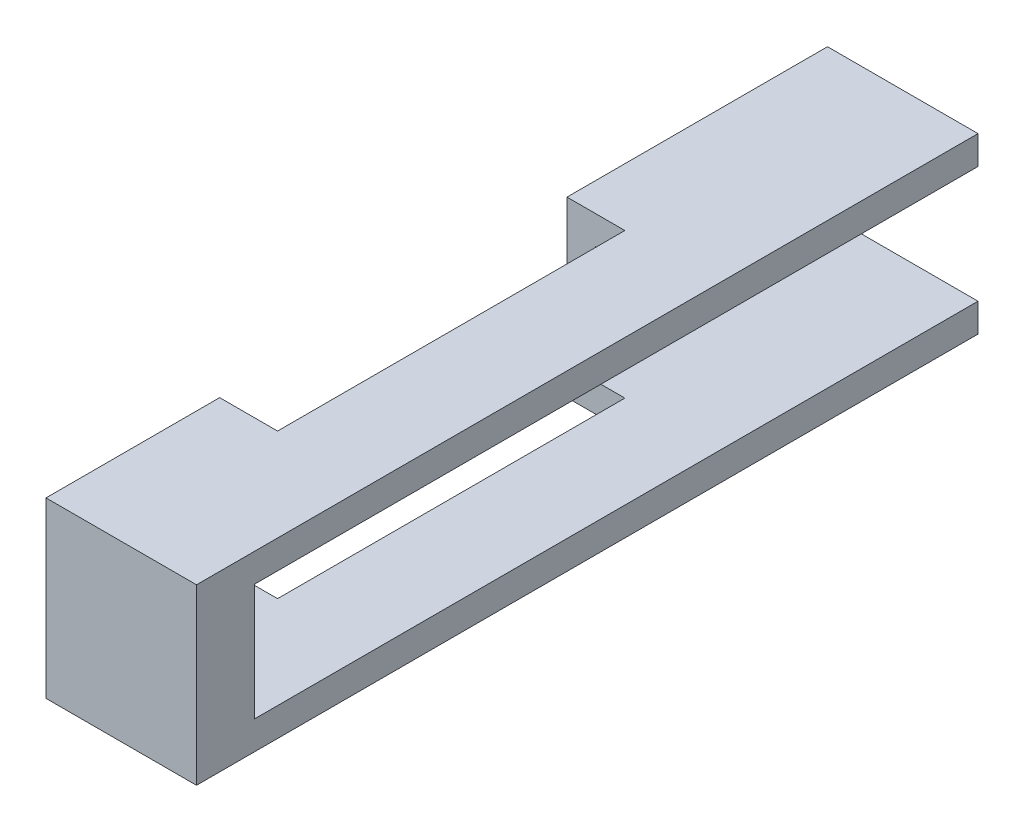
from build123d import *

# Parameters (mm, degrees)
SKETCH_1_W          = 30
SKETCH_1_H          = 30
EXTRUDE_1_DEPTH     = 30
SKETCH_2_W          = 20
SKETCH_2_H          = 20.05
CUT_EXTRUDE_1_DEPTH = 20
CUT_EXTRUDE_2_DEPTH = 20
SKETCH_4_W          = 5
SKETCH_4_H          = 30
CUT_EXTRUDE_3_DEPTH = 55
SKETCH_5_W          = 15
SKETCH_5_H          = 4.975
EXTRUDE_2_DEPTH     = 120
EXTRUDE_3_DEPTH     = 60
SKETCH_7_R          = 3.1
CUT_EXTRUDE_4_DEPTH = 60
CUT_EXTRUDE_5_REACH = 155.704
SKETCH_8_W          = 20.1
SKETCH_8_H          = 20.15
EXTRUDE_4_DEPTH     = 1
SKETCH_10_W         = 26
SKETCH_10_H         = 15
CUT_EXTRUDE_6_DEPTH = 87


with BuildPart() as part:
    # 草图1 → 凸台-拉伸1 (new body)
    with BuildSketch(Plane(origin=(0, 0, 0), x_dir=(1, 0, 0), z_dir=(0, 1, 0))):
        Rectangle(SKETCH_1_W, SKETCH_1_H)
    extrude(amount=EXTRUDE_1_DEPTH)

    # 草图2 → 切除-拉伸1 (cut)
    with BuildSketch(Plane(origin=(15, 0, 0), x_dir=(0, 0, -1), z_dir=(1, 0, 0))):
        with Locations((5, 15)):
            Rectangle(SKETCH_2_W, SKETCH_2_H)
    extrude(amount=-CUT_EXTRUDE_1_DEPTH, mode=Mode.SUBTRACT)

    # 草图3 → 切除-拉伸2 (cut)
    with BuildSketch(Plane(origin=(-5, 0, 0), x_dir=(0, 0, -1), z_dir=(1, 0, 0))):
        with BuildLine():
            ThreePointArc((7.189292698, 17.194765929), (5, 18.1), (2.810707302, 17.194765929))
            Line((2.810707302, 17.194765929), (5, 15))
            Line((5, 15), (7.189292698, 17.194765929))
        make_face()
        with BuildLine():
            Line((5, 15), (2.810707302, 17.194765929))
            ThreePointArc((2.810707302, 17.194765929), (1.9, 15), (2.810707302, 12.805234071))
            Line((2.810707302, 12.805234071), (5, 15))
        make_face()
        with BuildLine():
            Line((7.189292698, 17.194765929), (5, 15))
            Line((5, 15), (7.189292698, 12.805234071))
            ThreePointArc((7.189292698, 12.805234071), (7.86328547, 13.81189381), (8.1, 15))
            ThreePointArc((8.1, 15), (7.86328547, 16.18810619), (7.189292698, 17.194765929))
        make_face()
        with BuildLine():
            Line((7.189292698, 12.805234071), (5, 15))
            Line((5, 15), (2.810707302, 12.805234071))
            ThreePointArc((2.810707302, 12.805234071), (5, 11.9), (7.189292698, 12.805234071))
        make_face()
    extrude(amount=-CUT_EXTRUDE_2_DEPTH, mode=Mode.SUBTRACT)

    # 草图4 → 切除-拉伸3 (cut)
    with BuildSketch(Plane.XZ):
        with Locations((-12.5, 0)):
            Rectangle(SKETCH_4_W, SKETCH_4_H)
    extrude(amount=-CUT_EXTRUDE_3_DEPTH, mode=Mode.SUBTRACT)

    # 草图5 → 凸台-拉伸2 (add)
    with BuildSketch(Plane(origin=(0, 0, -15), x_dir=(-1, 0, 0), z_dir=(0, 0, -1))):
        with Locations((-7.5, 27.5125)):
            Rectangle(SKETCH_5_W, SKETCH_5_H)
        with Locations((-7.5, 2.4875)):
            Rectangle(SKETCH_5_W, SKETCH_5_H)
    extrude(amount=EXTRUDE_2_DEPTH)

    # 草图6 → 凸台-拉伸3 (add)
    with BuildSketch(Plane(origin=(0, 0, -135), x_dir=(-1, 0, 0), z_dir=(0, 0, -1))):
        Polygon((5, 4.975), (0, 4.975), (0, 0), (10, 0), (10, 30), (0, 30), (0, 25.025), (5, 25.025), align=None)
    extrude(amount=-EXTRUDE_3_DEPTH)

    # 草图7 → 切除-拉伸4 (cut)
    with BuildSketch(Plane.ZY.offset(10)):
        with Locations((-105, 15)):
            Circle(SKETCH_7_R)
        with Locations((-85, 15)):
            Circle(SKETCH_7_R)
    extrude(amount=-CUT_EXTRUDE_4_DEPTH, mode=Mode.SUBTRACT)

    # 切除-拉伸5: up to this face of the body (flat: up to its plane)
    cut_extrude_5_end = Plane(part.part.faces().sort_by_distance((5, 15, 5))[0])
    # 草图8 → 切除-拉伸5 (cut, up to the picked face)
    with BuildSketch(Plane(origin=(0, 0, -135), x_dir=(-1, 0, 0), z_dir=(0, 0, -1)), mode=Mode.PRIVATE) as cut_extrude_5_sk1:
        with Locations((-5, 15)):
            Rectangle(SKETCH_8_W, SKETCH_8_H)
    cut_extrude_5_tool1 = split(extrude(cut_extrude_5_sk1.sketch, amount=-CUT_EXTRUDE_5_REACH, mode=Mode.PRIVATE), bisect_by=cut_extrude_5_end, keep=Keep.BOTH, mode=Mode.PRIVATE)
    add(cut_extrude_5_tool1.solids().sort_by(Axis((5, 15, -135), (0, 0, 1)))[0], mode=Mode.SUBTRACT)

    # 草图9 → 凸台-拉伸4 (add)
    with BuildSketch(Plane(origin=(15, 0, 0), x_dir=(0, 0, -1), z_dir=(1, 0, 0))):
        Polygon((135, 4.925), (-5, 4.925), (-5, 25.075), (135, 25.075), (135, 30), (-15, 30), (-15, 0), (135, 0), align=None)
    extrude(amount=EXTRUDE_4_DEPTH)

    # 草图10 → 切除-拉伸6 (cut)
    with BuildSketch(Plane.XZ):
        with Locations((3, -127.5)):
            Rectangle(SKETCH_10_W, SKETCH_10_H)
    extrude(amount=-CUT_EXTRUDE_6_DEPTH, mode=Mode.SUBTRACT)


solid = part.part
